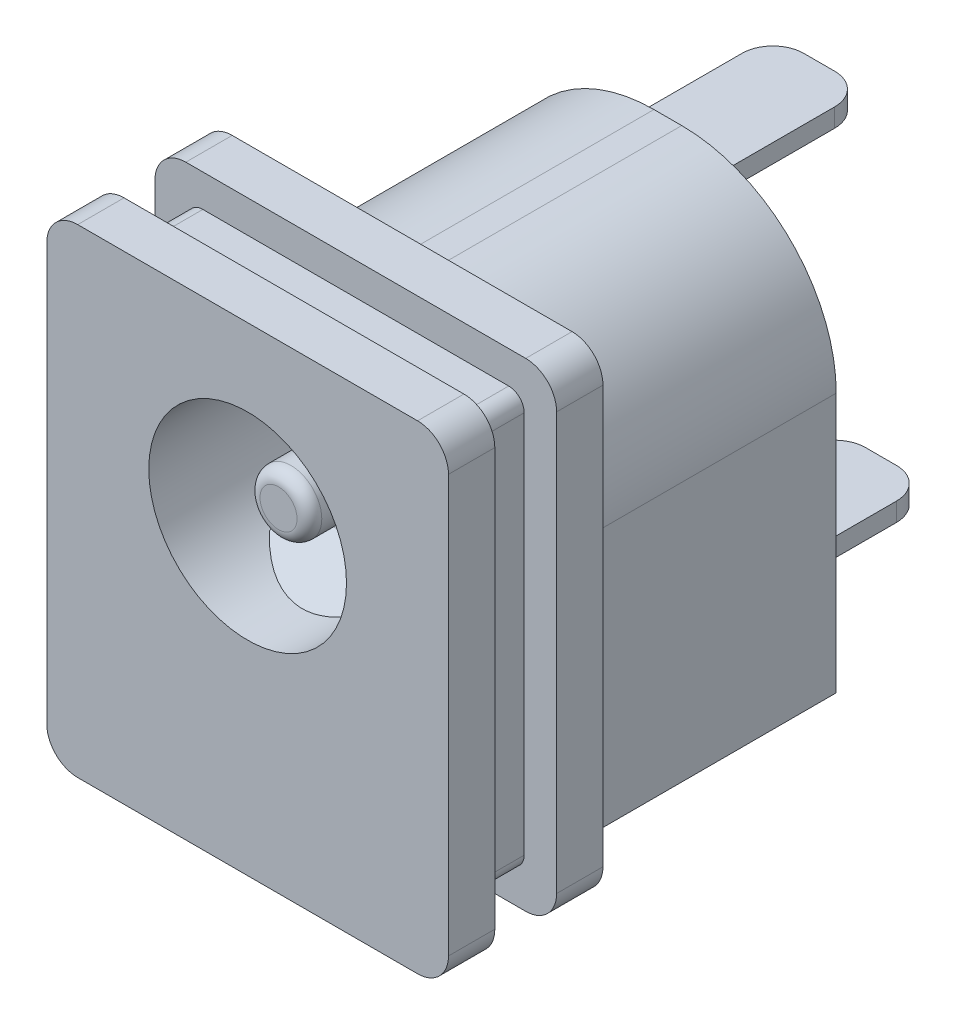
from build123d import *

# Parameters (mm, degrees)
EXTRUDE_1_DEPTH     = 1.5
EXTRUDE_2_DEPTH     = 2
EXTRUDE_START       = 1.5
EXTRUDE_3_DEPTH     = 1.5
EXTRUDE_4_DEPTH     = 8.6
SKETCH_5_R          = 3.2
CUT_EXTRUDE_1_DEPTH = 10
SKETCH_6_R          = 1
EXTRUDE_5_DEPTH     = 9
FILLET_1_R          = 0.4
SKETCH_8_W          = 4
SKETCH_8_H          = 0.3
SKETCH_11_W         = 3
SKETCH_11_H         = 0.6
EXTRUDE_6_DEPTH     = 4.9
SKETCH_12_W         = 3
SKETCH_12_H         = 5.5
EXTRUDE_7_DEPTH     = 0.8
SKETCH_13_R         = 1.25
EXTRUDE_8_DEPTH     = 1.6
FILLET_2_R          = 1
FILLET_3_R          = 1


with BuildPart() as part:
    # Эскиз1 → Бобышка-Вытянуть1 (new body)
    with BuildSketch(Plane.XY):
        with BuildLine():
            Line((5.5, -7.75), (-5.5, -7.75))
            ThreePointArc((-5.5, -7.75), (-6.207106781, -7.457106781), (-6.5, -6.75))
            Line((-6.5, -6.75), (-6.5, 6.75))
            ThreePointArc((-6.5, 6.75), (-6.207106781, 7.457106781), (-5.5, 7.75))
            Line((-5.5, 7.75), (5.5, 7.75))
            ThreePointArc((5.5, 7.75), (6.207106781, 7.457106781), (6.5, 6.75))
            Line((6.5, 6.75), (6.5, -6.75))
            ThreePointArc((6.5, -6.75), (6.207106781, -7.457106781), (5.5, -7.75))
        make_face()
    extrude(amount=EXTRUDE_1_DEPTH)

    # Эскиз2 → Бобышка-Вытянуть2 (add)
    with BuildSketch(Plane.XY):
        with BuildLine():
            Line((4.95, -6.7), (-4.95, -6.7))
            ThreePointArc((-4.95, -6.7), (-5.303553391, -6.553553391), (-5.45, -6.2))
            Line((-5.45, -6.2), (-5.45, 6.2))
            ThreePointArc((-5.45, 6.2), (-5.303553391, 6.553553391), (-4.95, 6.7))
            Line((-4.95, 6.7), (4.95, 6.7))
            ThreePointArc((4.95, 6.7), (5.303553391, 6.553553391), (5.45, 6.2))
            Line((5.45, 6.2), (5.45, -6.2))
            ThreePointArc((5.45, -6.2), (5.303553391, -6.553553391), (4.95, -6.7))
        make_face()
    extrude(amount=-EXTRUDE_2_DEPTH)

    # Эскиз3 → Бобышка-Вытянуть3 (add)
    with BuildSketch(Plane(origin=(0, 0, -2), x_dir=(-1, 0, 0), z_dir=(0, 0, -1)).offset(EXTRUDE_START)):
        with BuildLine():
            Line((-5.5, -7.75), (5.5, -7.75))
            ThreePointArc((5.5, -7.75), (6.207106781, -7.457106781), (6.5, -6.75))
            Line((6.5, -6.75), (6.5, 6.75))
            ThreePointArc((6.5, 6.75), (6.207106781, 7.457106781), (5.5, 7.75))
            Line((5.5, 7.75), (-5.5, 7.75))
            ThreePointArc((-5.5, 7.75), (-6.207106781, 7.457106781), (-6.5, 6.75))
            Line((-6.5, 6.75), (-6.5, -6.75))
            ThreePointArc((-6.5, -6.75), (-6.207106781, -7.457106781), (-5.5, -7.75))
        make_face()
    extrude(amount=-EXTRUDE_3_DEPTH)

    # Эскиз4 → Бобышка-Вытянуть4 (add)
    with BuildSketch(Plane(origin=(0, 0, -3.5), x_dir=(-1, 0, 0), z_dir=(0, 0, -1))):
        with BuildLine():
            Line((-5.45, -6.7), (5.45, -6.7))
            Line((5.45, -6.7), (5.45, 1.7))
            ThreePointArc((5.45, 1.7), (3.985533906, 5.235533906), (0.45, 6.7))
            Line((0.45, 6.7), (-0.45, 6.7))
            ThreePointArc((-0.45, 6.7), (-3.985533906, 5.235533906), (-5.45, 1.7))
            Line((-5.45, 1.7), (-5.45, -6.7))
        make_face()
    extrude(amount=EXTRUDE_4_DEPTH)

    # Эскиз5 → Вырез-Вытянуть1 (cut)
    with BuildSketch(Plane.XY.offset(1.5)):
        with Locations((0, 2.05)):
            Circle(SKETCH_5_R)
    extrude(amount=-CUT_EXTRUDE_1_DEPTH, mode=Mode.SUBTRACT)

    # Эскиз6 → Бобышка-Вытянуть5 (add)
    with BuildSketch(Plane.XY.offset(-8.5)):
        with Locations((0, 2.05)):
            Circle(SKETCH_6_R)
    extrude(amount=EXTRUDE_5_DEPTH)

    # Скругление1
    fillet_1_edges = [part.edges().sort_by_distance(p)[0] for p in [
        (-1, 2.05, 0.5),
    ]]
    fillet(fillet_1_edges, radius=FILLET_1_R)

    # По траектории1: sweep along a path in Эскиз9
    with BuildLine(Plane(origin=(0, 0, 0), x_dir=(0, 0, -1), z_dir=(1, 0, 0))) as sweep_1_path:
        Line((0, -1.5), (1.866666667, -0.1))
        ThreePointArc((1.866666667, -0.1), (2.008552784, -0.025658351), (2.166666667, 0))
        Line((2.166666667, 0), (2.833333333, 0))
        ThreePointArc((2.833333333, 0), (2.991447216, -0.025658351), (3.133333333, -0.1))
        Line((3.133333333, -0.1), (4.866666667, -1.4))
        ThreePointArc((4.866666667, -1.4), (5.008552784, -1.474341649), (5.166666667, -1.5))
        Line((5.166666667, -1.5), (8.166666667, -1.5))
    # Эскиз8 → По траектории1 (sweep)
    with BuildSketch(Plane.XY):
        with Locations((0, -1.5)):
            Rectangle(SKETCH_8_W, SKETCH_8_H)
    sweep(path=sweep_1_path.line)

    # Эскиз11 → Бобышка-Вытянуть6 (add)
    with BuildSketch(Plane(origin=(0, 0, -12.1), x_dir=(-1, 0, 0), z_dir=(0, 0, -1))):
        with Locations((-2, -4.55)):
            Rectangle(SKETCH_11_W, SKETCH_11_H)
        with Locations((2, -1.35)):
            Rectangle(SKETCH_11_W, SKETCH_11_H)
        with Locations((0, 5.5)):
            Rectangle(SKETCH_11_W, SKETCH_11_H)
    extrude(amount=EXTRUDE_6_DEPTH)

    # Эскиз12 → Бобышка-Вытянуть7 (add)
    with BuildSketch(Plane(origin=(0, 0, -12.1), x_dir=(-1, 0, 0), z_dir=(0, 0, -1))):
        with Locations((0, 3.05)):
            Rectangle(SKETCH_12_W, SKETCH_12_H)
    extrude(amount=EXTRUDE_7_DEPTH)

    # Эскиз13 → Бобышка-Вытянуть8 (add)
    with BuildSketch(Plane(origin=(0, 0, -12.1), x_dir=(-1, 0, 0), z_dir=(0, 0, -1))):
        with Locations((0, 2.05)):
            Circle(SKETCH_13_R)
    extrude(amount=EXTRUDE_8_DEPTH)

    # Скругление2
    fillet_2_edges = [part.edges().sort_by_distance(p)[0] for p in [
        (-1.5, 0.3, -12.5),
        (1.5, 0.3, -12.5),
    ]]
    fillet(fillet_2_edges, radius=FILLET_2_R)

    # Скругление3
    fillet_3_edges = [part.edges().sort_by_distance(p)[0] for p in [
        (-1.5, 5.5, -17),
        (1.5, 5.5, -17),
        (-3.5, -1.35, -17),
        (-0.5, -1.35, -17),
        (0.5, -4.55, -17),
        (3.5, -4.55, -17),
    ]]
    fillet(fillet_3_edges, radius=FILLET_3_R)


solid = part.part
